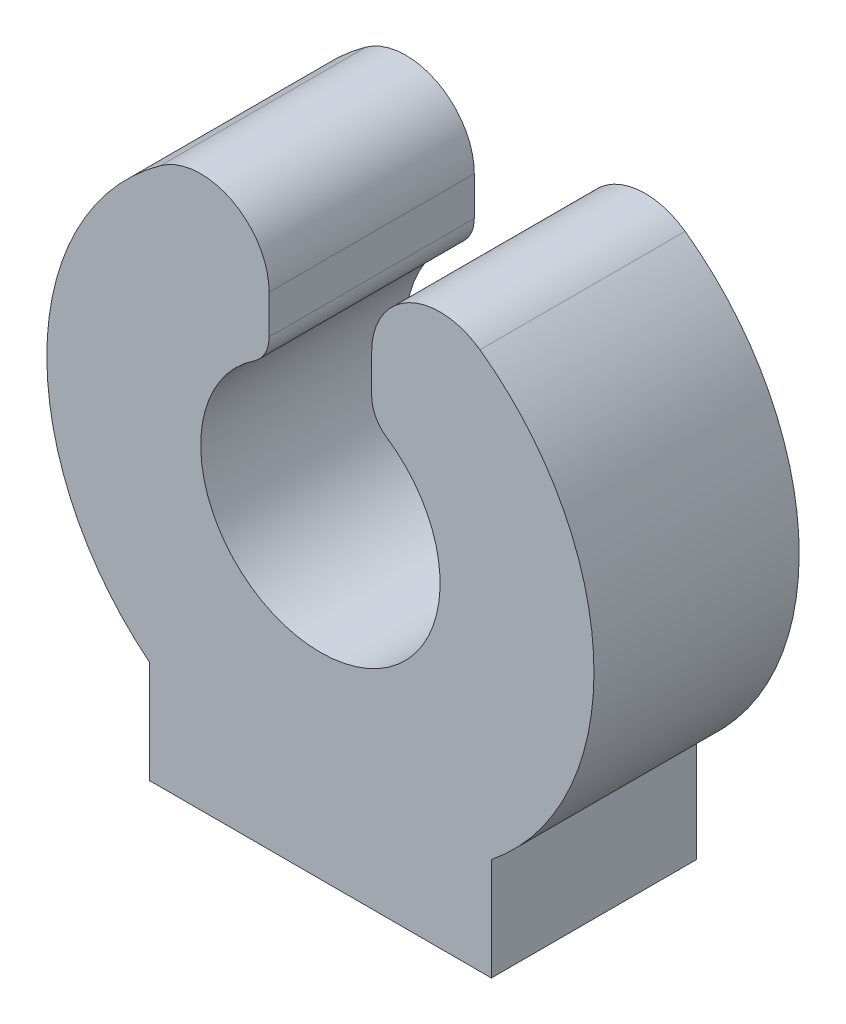
from build123d import *

# Parameters (mm, degrees)
SKETCH1_R           = 3.5
BOSS_EXTRUDE1_DEPTH = 6
SKETCH2_W           = 3
SKETCH2_H           = 6
CUT_EXTRUDE1_DEPTH  = 23.414057106
FILLET1_R           = 2
FILLET2_R           = 1


with BuildPart() as part:
    # Sketch1 → Boss-Extrude1 (new body)
    with BuildSketch(Plane.XY):
        with BuildLine():
            Line((0, 3), (0, 0))
            Line((0, 0), (10, 0))
            Line((10, 0), (10, 3))
            ThreePointArc((10, 3), (5, 17.244997998), (0, 3))
        make_face()
        with Locations((5, 9.244997998)):
            Circle(SKETCH1_R, mode=Mode.SUBTRACT)
    extrude(amount=BOSS_EXTRUDE1_DEPTH)

    # Sketch2 → Cut-Extrude1 (cut, through all)
    with BuildSketch(Plane.XY.offset(6)):
        with Locations((5, 15)):
            Rectangle(SKETCH2_W, SKETCH2_H)
    extrude(amount=-CUT_EXTRUDE1_DEPTH, mode=Mode.SUBTRACT)

    # Fillet1
    fillet1_edges = [part.edges().sort_by_distance(p)[0] for p in [
        (3.5, 17.103114821, 3),
        (6.5, 17.103114821, 3),
    ]]
    fillet(fillet1_edges, radius=FILLET1_R)

    # Fillet2
    fillet2_edges = [part.edges().sort_by_distance(p)[0] for p in [
        (6.5, 12.407275659, 3),
        (3.5, 12.407275659, 3),
    ]]
    fillet(fillet2_edges, radius=FILLET2_R)


solid = part.part
